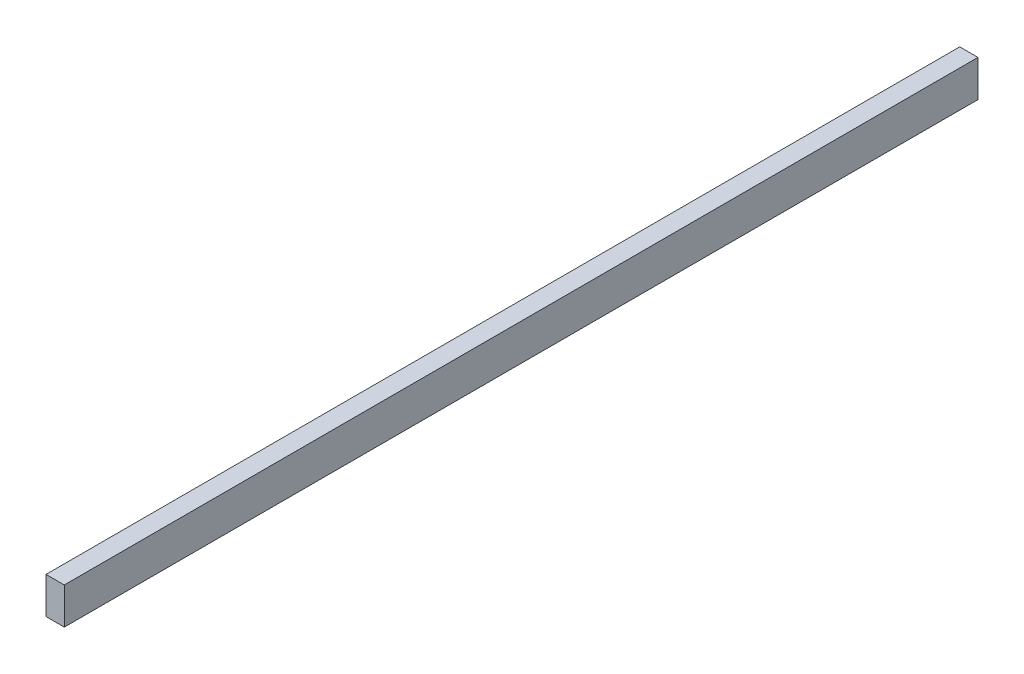
from build123d import *

# Parameters (mm, degrees)
SKETCH1_W           = 40
SKETCH1_H           = 80
BOSS_EXTRUDE1_DEPTH = 2000


with BuildPart() as part:
    # Sketch1 → Boss-Extrude1 (new body)
    with BuildSketch(Plane.XY):
        Rectangle(SKETCH1_W, SKETCH1_H)
    extrude(amount=BOSS_EXTRUDE1_DEPTH)


solid = part.part
